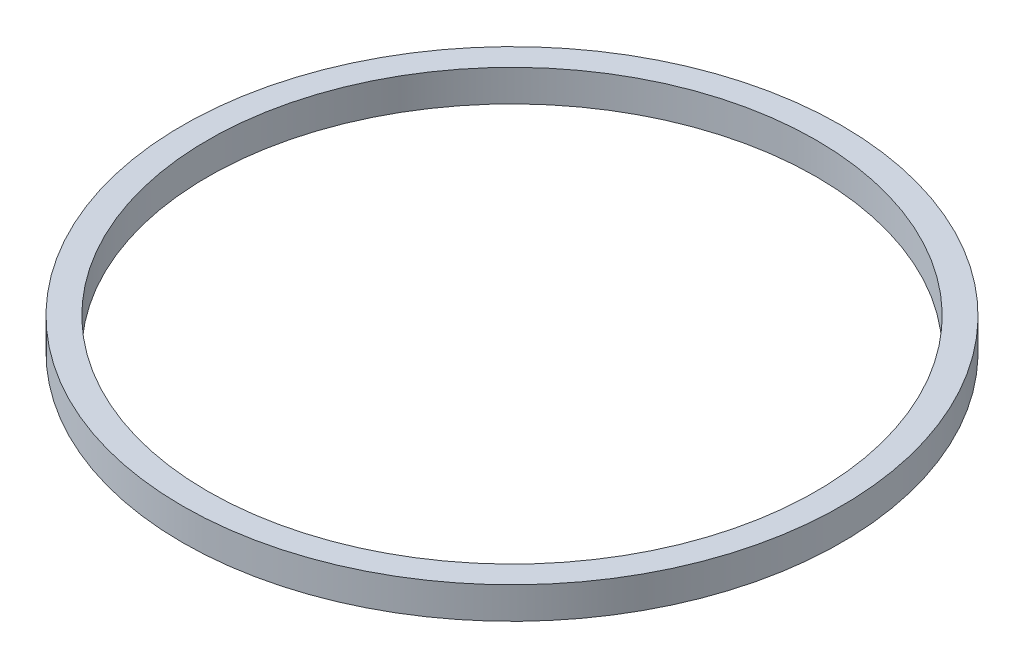
from build123d import *

# Parameters (mm, degrees)
SKETCH1_R           = 26
SKETCH1_R_2         = 24
BOSS_EXTRUDE1_DEPTH = 2.5


with BuildPart() as part:
    # Sketch1 → Boss-Extrude1 (new body)
    with BuildSketch(Plane(origin=(0, 0, 0), x_dir=(1, 0, 0), z_dir=(0, 1, 0))):
        with Locations(Location((0, 0, 0), (0, 0, 270))):
            Circle(SKETCH1_R)
        with Locations(Location((0, 0, 0), (0, 0, 270))):
            Circle(SKETCH1_R_2, mode=Mode.SUBTRACT)
    extrude(amount=BOSS_EXTRUDE1_DEPTH)


solid = part.part
